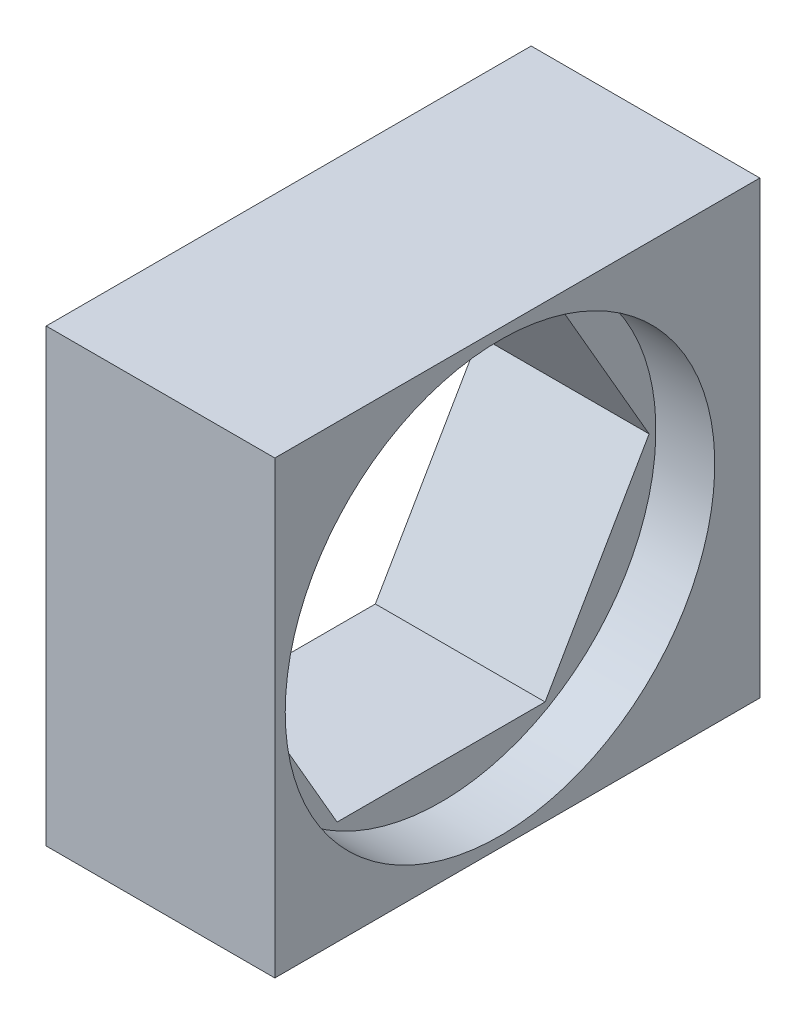
from build123d import *

# Parameters (mm, degrees)
NUT_CLIP_BLANK_SKETCH_W     = 6.6
NUT_CLIP_BLANK_SKETCH_H     = 13
NUT_CLIP_BLANK_DEPTH        = 14
M6_NUT_CLEARANCE_DEPTH      = 5.3
LOAD_WASHER_RELIEF_SKETCH_R = 6.2
LOAD_WASHER_RELIEF_DEPTH    = 1.9


with BuildPart() as part:
    # Nut clip blank sketch → Nut clip blank (new body)
    with BuildSketch(Plane.XY.offset(-27)):
        with Locations((44.408348754, -29)):
            Rectangle(NUT_CLIP_BLANK_SKETCH_W, NUT_CLIP_BLANK_SKETCH_H)
    extrude(amount=NUT_CLIP_BLANK_DEPTH)

    # M6 nut clearance sketch → M6 nut clearance (cut)
    with BuildSketch(Plane(origin=(41.008348754, 0, 0), x_dir=(0, 0, -1), z_dir=(1, 0, 0))):
        Polygon((16.4977786, -23.8), (13.4955572, -29), (16.4977786, -34.2), (22.5022214, -34.2), (25.5044428, -29), (22.5022214, -23.8), align=None)
    extrude(amount=M6_NUT_CLEARANCE_DEPTH, mode=Mode.SUBTRACT)

    # Load washer relief sketch → Load washer relief (cut)
    with BuildSketch(Plane(origin=(46.008348754, 0, 0), x_dir=(0, 0, -1), z_dir=(1, 0, 0))):
        with Locations(Location((19.5, -29, 0), (0, 0, 180))):
            Circle(LOAD_WASHER_RELIEF_SKETCH_R)
    extrude(amount=LOAD_WASHER_RELIEF_DEPTH, mode=Mode.SUBTRACT)


solid = part.part
